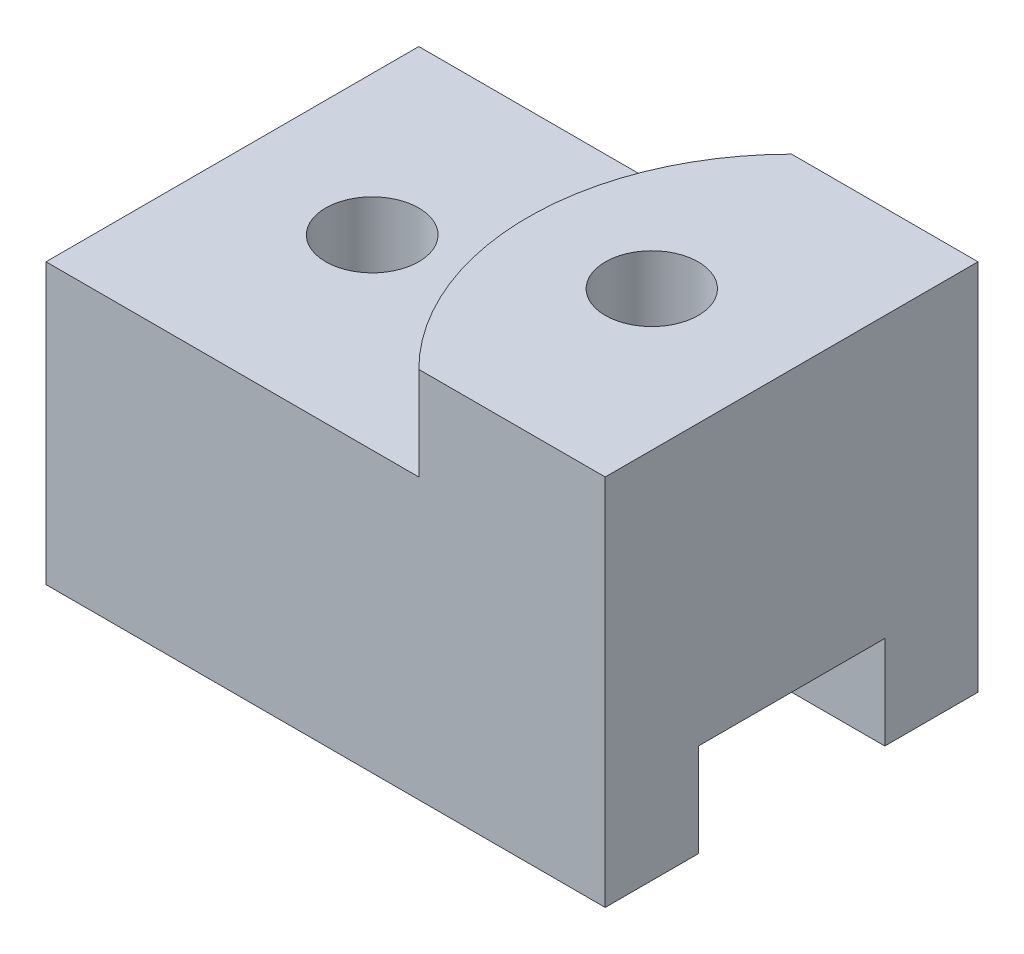
from build123d import *

# Parameters (mm, degrees)
SKETCH1_W           = 152.4
SKETCH1_H           = 101.6
BOSS_EXTRUDE1_DEPTH = 101.6
SKETCH2_W           = 152.4
SKETCH2_H           = 50.8
CUT_EXTRUDE1_DEPTH  = 25.4
SKETCH3_W           = 76.2
SKETCH3_H           = 101.6
CUT_EXTRUDE2_DEPTH  = 25.4
SKETCH4_W           = 76.2
SKETCH4_H           = 101.6
CUT_EXTRUDE3_DEPTH  = 25.4
BOSS_EXTRUDE2_DEPTH = 25.4
SKETCH6_R           = 12.665162167
CUT_EXTRUDE6_DEPTH  = 101.6
SKETCH7_R           = 12.7
CUT_EXTRUDE7_DEPTH  = 50.8
SKETCH8_R           = 19.05
CUT_EXTRUDE8_DEPTH  = 8.382


with BuildPart() as part:
    # Sketch1 → Boss-Extrude1 (new body)
    with BuildSketch(Plane(origin=(0, 0, 0), x_dir=(1, 0, 0), z_dir=(0, 1, 0))):
        with Locations((76.2, 50.8)):
            Rectangle(SKETCH1_W, SKETCH1_H)
    extrude(amount=BOSS_EXTRUDE1_DEPTH)

    # Sketch2 → Cut-Extrude1 (cut)
    with BuildSketch(Plane(origin=(0, 0, 0), x_dir=(-1, 0, 0), z_dir=(0, -1, 0))):
        with Locations((-76.2, 50.8)):
            Rectangle(SKETCH2_W, SKETCH2_H)
    extrude(amount=-CUT_EXTRUDE1_DEPTH, mode=Mode.SUBTRACT)

    # Sketch3 → Cut-Extrude2 (cut)
    with BuildSketch(Plane(origin=(0, 101.6, 0), x_dir=(1, 0, 0), z_dir=(0, 1, 0))):
        with Locations((38.1, 50.8)):
            Rectangle(SKETCH3_W, SKETCH3_H)
    extrude(amount=-CUT_EXTRUDE2_DEPTH, mode=Mode.SUBTRACT)

    # Sketch4 → Cut-Extrude3 (cut)
    with BuildSketch(Plane(origin=(0, 101.6, 0), x_dir=(1, 0, 0), z_dir=(0, 1, 0))):
        with Locations((114.3, 50.8)):
            Rectangle(SKETCH4_W, SKETCH4_H)
    extrude(amount=-CUT_EXTRUDE3_DEPTH, mode=Mode.SUBTRACT)

    # Sketch5 → Boss-Extrude2 (add)
    with BuildSketch(Plane(origin=(0, 76.2, 0), x_dir=(1, 0, 0), z_dir=(0, 1, 0))):
        with BuildLine():
            Line((152.4, 0), (101.6, 0))
            ThreePointArc((101.6, 0), (80.557951031, 50.8), (101.6, 101.6))
            Line((101.6, 101.6), (152.4, 101.6))
            Line((152.4, 101.6), (152.4, 0))
        make_face()
    extrude(amount=BOSS_EXTRUDE2_DEPTH)

    # Sketch6 → Cut-Extrude6 (cut)
    with BuildSketch(Plane(origin=(0, 101.6, 0), x_dir=(1, 0, 0), z_dir=(0, 1, 0))):
        with Locations(Location((114.3, 50.8, 0), (0, 0, 270))):
            Circle(SKETCH6_R)
    extrude(amount=-CUT_EXTRUDE6_DEPTH, mode=Mode.SUBTRACT)

    # Sketch7 → Cut-Extrude7 (cut)
    with BuildSketch(Plane(origin=(0, 76.2, 0), x_dir=(1, 0, 0), z_dir=(0, 1, 0))):
        with Locations(Location((38.1, 50.8, 0), (0, 0, 270))):
            Circle(SKETCH7_R)
    extrude(amount=-CUT_EXTRUDE7_DEPTH, mode=Mode.SUBTRACT)

    # Sketch8 → Cut-Extrude8 (cut)
    with BuildSketch(Plane.XZ.offset(-25.4)):
        with Locations(Location((38.1, -50.8, 0), (0, 0, 270))):
            Circle(SKETCH8_R)
    extrude(amount=-CUT_EXTRUDE8_DEPTH, mode=Mode.SUBTRACT)


solid = part.part
